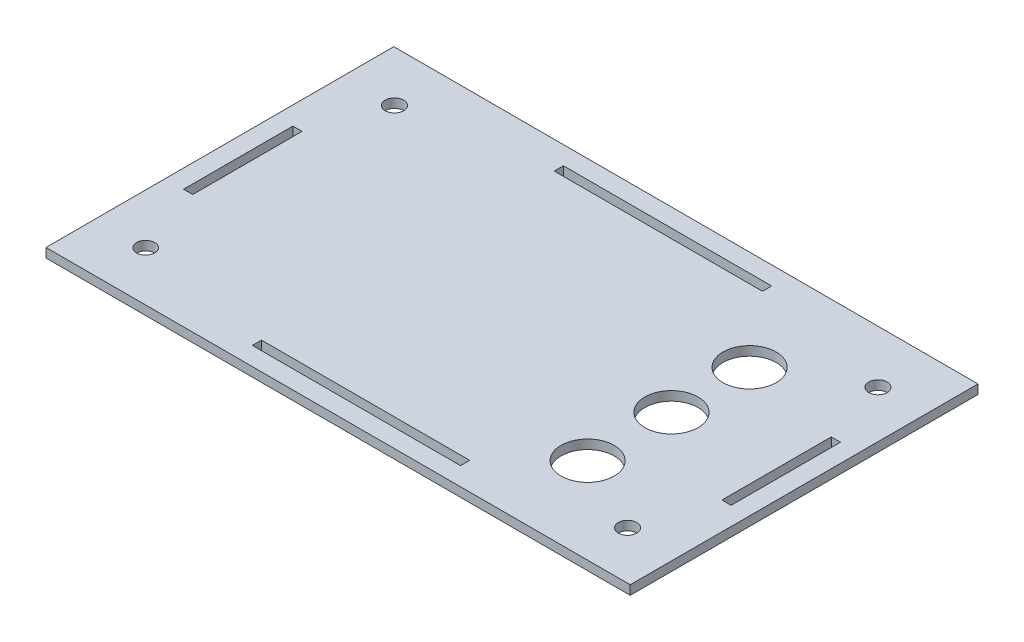
from build123d import *

# Parameters (mm, degrees)
SKETCH2_W           = 127.41
SKETCH2_H           = 75.848
SKETCH2_R           = 5.8
SKETCH2_R_2         = 1.975434392
SKETCH2_R_3         = 2.02059866
SKETCH2_R_4         = 2.005784304
SKETCH2_R_5         = 2.007647525
SKETCH2_W_2         = 2
SKETCH2_H_2         = 23.848
SKETCH2_W_3         = 45.41
SKETCH2_H_3         = 2
BOSS_EXTRUDE1_DEPTH = 2


with BuildPart() as part:
    # Sketch2 → Boss-Extrude1 (new body)
    with BuildSketch(Plane(origin=(0, 0, 0), x_dir=(1, 0, 0), z_dir=(0, 1, 0))):
        with Locations((56.48154317, 30.702122774)):
            Rectangle(SKETCH2_W, SKETCH2_H)
        with Locations(Location((92.113682499, 29.850625922, 0), (0, 0, 270))):
            Circle(SKETCH2_R, mode=Mode.SUBTRACT)
        with Locations(Location((92.113682499, 11.563322273, 0), (0, 0, 270))):
            Circle(SKETCH2_R, mode=Mode.SUBTRACT)
        with Locations(Location((92.131948628, 46.863483745, 0), (0, 0, 270))):
            Circle(SKETCH2_R, mode=Mode.SUBTRACT)
        with Locations(Location((3.695346689, 3.585176853, 0), (0, 0, 270))):
            Circle(SKETCH2_R_2, mode=Mode.SUBTRACT)
        with Locations(Location((3.945209928, 57.606557407, 0), (0, 0, 270))):
            Circle(SKETCH2_R_3, mode=Mode.SUBTRACT)
        with Locations(Location((109.903070514, 57.08563935, 0), (0, 0, 270))):
            Circle(SKETCH2_R_4, mode=Mode.SUBTRACT)
        with Locations(Location((109.140500171, 3.238215507, 0), (0, 0, 270))):
            Circle(SKETCH2_R_5, mode=Mode.SUBTRACT)
        with Locations((-2.22345683, 30.702122774)):
            Rectangle(SKETCH2_W_2, SKETCH2_H_2, mode=Mode.SUBTRACT)
        with Locations((56.48154317, 63.626122774)):
            Rectangle(SKETCH2_W_3, SKETCH2_H_3, mode=Mode.SUBTRACT)
        with Locations((115.18654317, 30.702122774)):
            Rectangle(SKETCH2_W_2, SKETCH2_H_2, mode=Mode.SUBTRACT)
        with Locations((56.48154317, -2.221877226)):
            Rectangle(SKETCH2_W_3, SKETCH2_H_3, mode=Mode.SUBTRACT)
    extrude(amount=BOSS_EXTRUDE1_DEPTH)


solid = part.part
